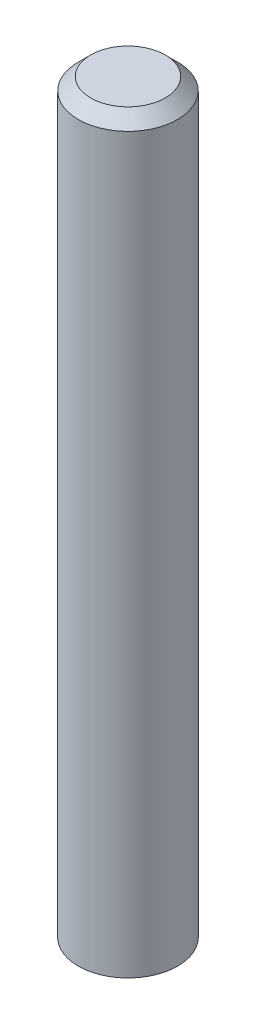
from build123d import *

# Parameters (mm, degrees)
SKETCH1_R           = 4
BOSS_EXTRUDE1_DEPTH = 60
CHAMFER1_SIZE       = 1


with BuildPart() as part:
    # Sketch1 → Boss-Extrude1 (new body)
    with BuildSketch(Plane(origin=(0, 0, 0), x_dir=(1, 0, 0), z_dir=(0, 1, 0))):
        with Locations(Location((0, 0, 0), (0, 0, 270))):
            Circle(SKETCH1_R)
    extrude(amount=BOSS_EXTRUDE1_DEPTH)

    # Chamfer1
    chamfer1_edges = [part.edges().sort_by_distance(p)[0] for p in [
        (0, 60, -4),
    ]]
    chamfer(chamfer1_edges, length=CHAMFER1_SIZE)


solid = part.part
